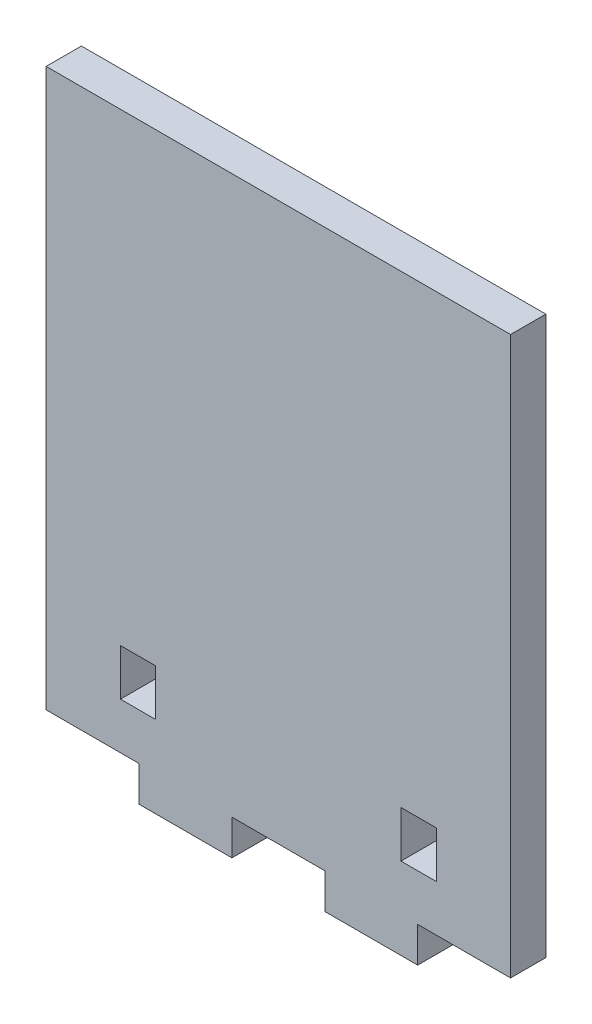
from build123d import *

# Parameters (mm, degrees)
SKETCH1_W           = 63.5
SKETCH1_H           = 81.026
BOSS_EXTRUDE1_DEPTH = 4.826
SKETCH2_W           = 12.7
SKETCH2_H           = 4.826
CUT_EXTRUDE1_DEPTH  = 104.057037373
SKETCH3_W           = 4.826
SKETCH3_H           = 6.35
CUT_EXTRUDE2_DEPTH  = 4.826


with BuildPart() as part:
    # Sketch1 → Boss-Extrude1 (new body)
    with BuildSketch(Plane.XY):
        with Locations((31.75, 40.513)):
            Rectangle(SKETCH1_W, SKETCH1_H)
    extrude(amount=BOSS_EXTRUDE1_DEPTH)

    # Sketch2 → Cut-Extrude1 (cut, through all)
    with BuildSketch(Plane.XY.offset(4.826)):
        with Locations((6.35, 2.413)):
            Rectangle(SKETCH2_W, SKETCH2_H)
        with Locations((31.75, 2.413)):
            Rectangle(SKETCH2_W, SKETCH2_H)
        with Locations((57.15, 2.413)):
            Rectangle(SKETCH2_W, SKETCH2_H)
    extrude(amount=-CUT_EXTRUDE1_DEPTH, mode=Mode.SUBTRACT)

    # Sketch3 → Cut-Extrude2 (cut)
    with BuildSketch(Plane(origin=(0, 0, 0), x_dir=(-1, 0, 0), z_dir=(0, 0, -1))):
        with Locations((-50.927, 14.351)):
            Rectangle(SKETCH3_W, SKETCH3_H)
        with Locations((-12.573, 14.351)):
            Rectangle(SKETCH3_W, SKETCH3_H)
    extrude(amount=-CUT_EXTRUDE2_DEPTH, mode=Mode.SUBTRACT)


solid = part.part
